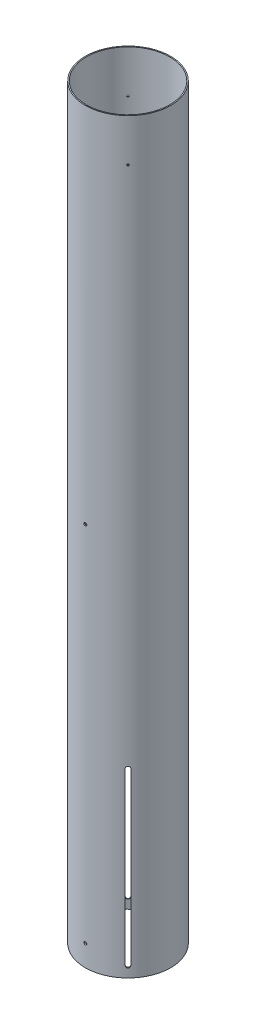
from build123d import *

# Parameters (mm, degrees)
SKETCH1_R           = 50.8
SKETCH1_R_2         = 49.53
BOSS_EXTRUDE1_DEPTH = 889
CUT_EXTRUDE1_DEPTH  = 152.4
CIRPATTERN1_COUNT   = 4
SKETCH3_R           = 1.7653
CUT_EXTRUDE2_DEPTH  = 11.684
SKETCH4_R           = 1.0922
CUT_EXTRUDE3_DEPTH  = 25.4
CIRPATTERN2_COUNT   = 2


with BuildPart() as part:
    # Sketch1 → Boss-Extrude1 (new body)
    with BuildSketch(Plane(origin=(0, 0, 0), x_dir=(1, 0, 0), z_dir=(0, 1, 0))):
        with Locations(Location((0, 0, 0), (0, 0, 270))):
            Circle(SKETCH1_R)
        with Locations(Location((0, 0, 0), (0, 0, 270))):
            Circle(SKETCH1_R_2, mode=Mode.SUBTRACT)
    extrude(amount=BOSS_EXTRUDE1_DEPTH)

    # Sketch2 → Cut-Extrude1 (cut)
    with BuildSketch(Plane(origin=(14.492117094, 1243.355570529, -192.628510082), x_dir=(0, 1, 0), z_dir=(0.7071067811865634, 0, -0.7071067811865316))):
        with BuildLine():
            Line((-1230.655570529, 128.342701458), (-1027.455570529, 128.342701458))
            ThreePointArc((-1027.455570529, 128.342701458), (-1025.074320529, 125.961451458), (-1027.455570529, 123.580201458))
            Line((-1027.455570529, 123.580201458), (-1230.655570529, 123.580201458))
            ThreePointArc((-1230.655570529, 123.580201458), (-1233.036820529, 125.961451458), (-1230.655570529, 128.342701458))
        make_face()
    cut_extrude1 = extrude(amount=-CUT_EXTRUDE1_DEPTH, mode=Mode.SUBTRACT)

    # CirPattern1: Cut-Extrude1 ×4 about axis
    cirpattern1_axis = Axis((0, 0, 0), (0, 1, 0))
    for i in range(1, CIRPATTERN1_COUNT):
        add(cut_extrude1.rotate(cirpattern1_axis, i * 360 / CIRPATTERN1_COUNT), mode=Mode.SUBTRACT)

    # Sketch3 → Cut-Extrude2 (cut)
    with BuildSketch(Plane(origin=(271.091614788, 1243.355570529, 52.3875), x_dir=(-1, 0, 0), z_dir=(0, 0, 1))):
        with Locations(Location((271.091614788, 1217.955570529, 0), (0, 0, 180))):
            Circle(SKETCH3_R)
        with Locations(Location((271.091614788, 786.155570529, 0), (0, 0, 180))):
            Circle(SKETCH3_R)
    extrude(amount=-CUT_EXTRUDE2_DEPTH, mode=Mode.SUBTRACT)

    # Sketch4 → Cut-Extrude3 (cut)
    with BuildSketch(Plane(origin=(120.58027232, 708.404628356, -48.738223352), x_dir=(-0.7071067811865634, 2.660214291711019e-15, 0.7071067811865317), z_dir=(0.7071067811865317, -1.2152886494782433e-14, 0.7071067811865634))):
        with Locations(Location((119.72625647, -129.795371644, 0), (0, 0, 180))):
            Circle(SKETCH4_R)
    cut_extrude3 = extrude(amount=-CUT_EXTRUDE3_DEPTH, mode=Mode.SUBTRACT)

    # CirPattern2: Cut-Extrude3 ×2 about axis
    cirpattern2_axis = Axis((0, 889, 0), (0, -1, 0))
    for i in range(1, CIRPATTERN2_COUNT):
        add(cut_extrude3.rotate(cirpattern2_axis, i * 360 / CIRPATTERN2_COUNT), mode=Mode.SUBTRACT)


solid = part.part
